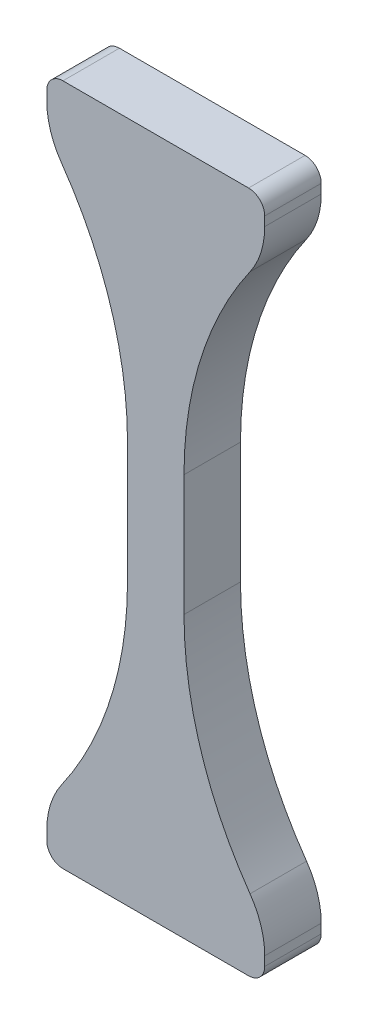
from build123d import *

# Parameters (mm, degrees)
BOSS_EXTRUDE1_DEPTH = 7


with BuildPart() as part:
    # Sketch1 → Boss-Extrude1 (new body)
    with BuildSketch(Plane.XY):
        with BuildLine():
            Line((-13.5, -1.520113715), (-13.5, -0.377223398))
            ThreePointArc((-13.5, -0.377223398), (-12.914213562, 1.036990164), (-11.5, 1.622776602))
            Line((-11.5, 1.622776602), (11.5, 1.622776602))
            ThreePointArc((11.5, 1.622776602), (12.914213562, 1.036990164), (13.5, -0.377223398))
            Line((13.5, -0.377223398), (13.5, -1.520113715))
            ThreePointArc((13.5, -1.520113715), (13.034625892, -4.535227161), (11.681818182, -7.269709461))
            ThreePointArc((11.681818182, -7.269709461), (5.594183484, -19.574879811), (3.5, -33.142890317))
            Line((3.5, -33.142890317), (3.5, -40.642890317))
            Line((3.5, -40.642890317), (-3.5, -40.642890317))
            Line((-3.5, -40.642890317), (-3.5, -33.142890317))
            ThreePointArc((-3.5, -33.142890317), (-5.594183484, -19.574879811), (-11.681818182, -7.269709461))
            ThreePointArc((-11.681818182, -7.269709461), (-13.034625892, -4.535227161), (-13.5, -1.520113715))
        make_face()
    boss_extrude1 = extrude(amount=BOSS_EXTRUDE1_DEPTH)

    # Mirror1: Boss-Extrude1 across plane
    add(boss_extrude1.mirror(Plane(origin=(3.5, -40.642890317, 7), x_dir=(0, 0, 1), z_dir=(0, 1, 0))))


solid = part.part
